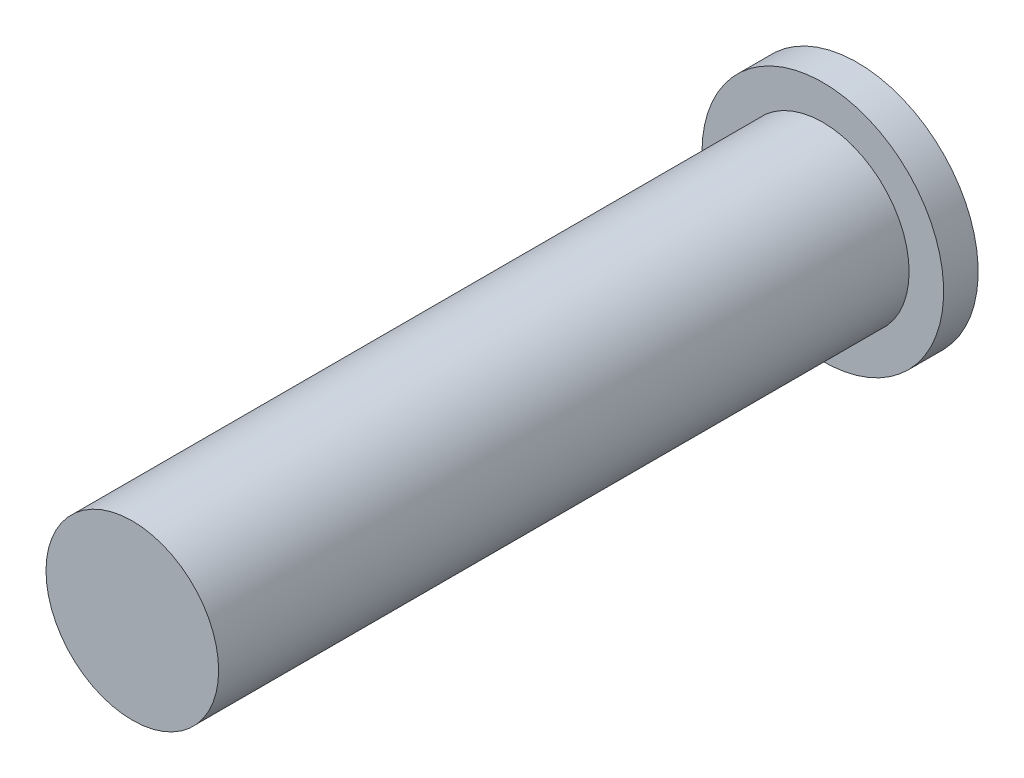
from build123d import *

# Parameters (mm, degrees)
SKETCH1_R           = 5
BOSS_EXTRUDE1_DEPTH = 40
SKETCH2_R           = 7
BOSS_EXTRUDE2_DEPTH = 2


with BuildPart() as part:
    # Sketch1 → Boss-Extrude1 (new body)
    with BuildSketch(Plane.XY):
        Circle(SKETCH1_R)
    extrude(amount=BOSS_EXTRUDE1_DEPTH)

    # Sketch2 → Boss-Extrude2 (add)
    with BuildSketch(Plane(origin=(0, 0, 0), x_dir=(-1, 0, 0), z_dir=(0, 0, -1))):
        Circle(SKETCH2_R)
    extrude(amount=BOSS_EXTRUDE2_DEPTH)


solid = part.part
